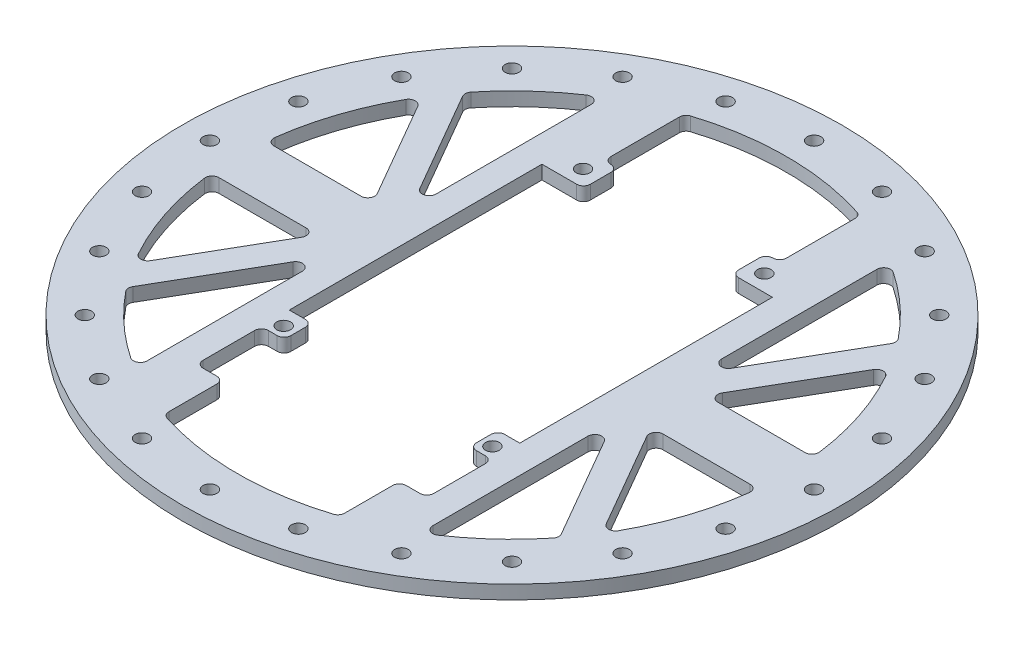
from build123d import *

# Parameters (mm, degrees)
SKETCH1_R           = 76.199999999
SKETCH1_R_2         = 1.5875
BOSS_EXTRUDE1_DEPTH = 3.175


with BuildPart() as part:
    # Sketch1 → Boss-Extrude1 (new body)
    with BuildSketch(Plane(origin=(0, 0, 0), x_dir=(1, 0, 0), z_dir=(0, 1, 0))):
        with Locations(Location((1e-09, -1e-09, 0), (0, 0, 270))):
            Circle(SKETCH1_R)
        with Locations(Location((-34.925, 60.491874454, 0), (0, 0, 270))):
            Circle(SKETCH1_R_2, mode=Mode.SUBTRACT)
        with Locations(Location((20.847659999, 37.48772538, 0), (0, 0, 270))):
            Circle(SKETCH1_R_2, mode=Mode.SUBTRACT)
        with Locations(Location((-18.0785103, -67.469918966, 0), (0, 0, 270))):
            Circle(SKETCH1_R_2, mode=Mode.SUBTRACT)
        with Locations(Location((-49.391408667, -49.391408667, 0), (0, 0, 270))):
            Circle(SKETCH1_R_2, mode=Mode.SUBTRACT)
        with Locations(Location((-67.469918966, -18.0785103, 0), (0, 0, 270))):
            Circle(SKETCH1_R_2, mode=Mode.SUBTRACT)
        with Locations(Location((-67.469918966, 18.0785103, 0), (0, 0, 270))):
            Circle(SKETCH1_R_2, mode=Mode.SUBTRACT)
        with Locations(Location((-49.391408667, 49.391408667, 0), (0, 0, 270))):
            Circle(SKETCH1_R_2, mode=Mode.SUBTRACT)
        with Locations(Location((-18.0785103, 67.469918966, 0), (0, 0, 270))):
            Circle(SKETCH1_R_2, mode=Mode.SUBTRACT)
        with Locations(Location((18.0785103, 67.469918966, 0), (0, 0, 270))):
            Circle(SKETCH1_R_2, mode=Mode.SUBTRACT)
        with Locations(Location((49.391408667, 49.391408667, 0), (0, 0, 270))):
            Circle(SKETCH1_R_2, mode=Mode.SUBTRACT)
        with Locations(Location((67.469918966, 18.0785103, 0), (0, 0, 270))):
            Circle(SKETCH1_R_2, mode=Mode.SUBTRACT)
        with Locations(Location((67.469918966, -18.0785103, 0), (0, 0, 270))):
            Circle(SKETCH1_R_2, mode=Mode.SUBTRACT)
        with Locations(Location((49.391408667, -49.391408667, 0), (0, 0, 270))):
            Circle(SKETCH1_R_2, mode=Mode.SUBTRACT)
        with Locations(Location((18.0785103, -67.469918966, 0), (0, 0, 270))):
            Circle(SKETCH1_R_2, mode=Mode.SUBTRACT)
        with Locations(Location((0, -69.85, 0), (0, 0, 270))):
            Circle(SKETCH1_R_2, mode=Mode.SUBTRACT)
        with Locations(Location((-24.237340001, -28.55227462, 0), (0, 0, 270))):
            Circle(SKETCH1_R_2, mode=Mode.SUBTRACT)
        with Locations(Location((34.925, -60.491874454, 0), (0, 0, 270))):
            Circle(SKETCH1_R_2, mode=Mode.SUBTRACT)
        with Locations(Location((60.491874454, -34.925, 0), (0, 0, 270))):
            Circle(SKETCH1_R_2, mode=Mode.SUBTRACT)
        with Locations(Location((69.85, 0, 0), (0, 0, 270))):
            Circle(SKETCH1_R_2, mode=Mode.SUBTRACT)
        with Locations(Location((60.491874454, 34.925, 0), (0, 0, 270))):
            Circle(SKETCH1_R_2, mode=Mode.SUBTRACT)
        with Locations(Location((34.925, 60.491874454, 0), (0, 0, 270))):
            Circle(SKETCH1_R_2, mode=Mode.SUBTRACT)
        with Locations(Location((0, 69.85, 0), (0, 0, 270))):
            Circle(SKETCH1_R_2, mode=Mode.SUBTRACT)
        with Locations(Location((-60.491874454, 34.925, 0), (0, 0, 270))):
            Circle(SKETCH1_R_2, mode=Mode.SUBTRACT)
        with Locations(Location((-69.85, 0, 0), (0, 0, 270))):
            Circle(SKETCH1_R_2, mode=Mode.SUBTRACT)
        with Locations(Location((-60.491874454, -34.925, 0), (0, 0, 270))):
            Circle(SKETCH1_R_2, mode=Mode.SUBTRACT)
        with Locations(Location((-34.925, -60.491874454, 0), (0, 0, 270))):
            Circle(SKETCH1_R_2, mode=Mode.SUBTRACT)
        with Locations(Location((24.022659999, -28.55227462, 0), (0, 0, 270))):
            Circle(SKETCH1_R_2, mode=Mode.SUBTRACT)
        with Locations(Location((-21.062340001, 37.48772538, 0), (0, 0, 270))):
            Circle(SKETCH1_R_2, mode=Mode.SUBTRACT)
        with BuildLine():
            Line((-52.709304986, 30.9278766), (-39.894076642, 8.731249997))
            ThreePointArc((-39.894076642, 8.731249997), (-39.894076641, 7.143749998), (-41.268891969, 6.349999997))
            Line((-41.268891969, 6.349999997), (-61.401577747, 6.349999997))
            ThreePointArc((-61.401577747, 6.349999997), (-62.593897588, 6.889392346), (-62.975977177, 8.141025638))
            ThreePointArc((-62.975977177, 8.141025638), (-60.307423445, 19.881264477), (-55.47089263, 30.906796512))
            ThreePointArc((-55.47089263, 30.906796512), (-54.096237859, 31.721580352), (-52.709304986, 30.9278766))
        make_face(mode=Mode.SUBTRACT)
        with BuildLine():
            Line((-33.019999998, -15.44963066), (-33.019999998, -51.336912647))
            ThreePointArc((-33.019999998, -51.336912647), (-33.862029165, -52.738493715), (-35.494871793, -52.653243741))
            ThreePointArc((-35.494871793, -52.653243741), (-42.917583757, -46.80097226), (-49.389337066, -39.911694831))
            ThreePointArc((-49.389337066, -39.911694831), (-49.737272965, -39.037652438), (-49.529418968, -38.12015246))
            Line((-49.529418968, -38.12015246), (-35.982315328, -14.65588066))
            ThreePointArc((-35.982315328, -14.65588066), (-34.196624765, -13.916223409), (-33.019999998, -15.44963066))
        make_face(mode=Mode.SUBTRACT)
        with BuildLine():
            Line((33.020000001, -51.336912648), (33.020000001, -15.449630661))
            ThreePointArc((33.020000001, -15.449630661), (34.196624767, -13.916223411), (35.98231533, -14.655880661))
            Line((35.98231533, -14.655880661), (49.529418969, -38.12015246))
            ThreePointArc((49.529418969, -38.12015246), (49.737272966, -39.037652438), (49.389337068, -39.911694831))
            ThreePointArc((49.389337068, -39.911694831), (42.91758376, -46.80097226), (35.494871796, -52.653243741))
            ThreePointArc((35.494871796, -52.653243741), (33.862029168, -52.738493715), (33.020000001, -51.336912648))
        make_face(mode=Mode.SUBTRACT)
        with BuildLine():
            Line((49.529418968, 38.120152454), (35.982315328, 14.655880655))
            ThreePointArc((35.982315328, 14.655880655), (34.196624767, 13.916223407), (33.020000001, 15.449630655))
            Line((33.020000001, 15.449630655), (33.020000001, 51.336912642))
            ThreePointArc((33.020000001, 51.336912642), (33.862029167, 52.738493709), (35.494871796, 52.653243736))
            ThreePointArc((35.494871796, 52.653243736), (42.91758376, 46.800972255), (49.389337068, 39.911694825))
            ThreePointArc((49.389337068, 39.911694825), (49.737272966, 39.037652432), (49.529418968, 38.120152454))
        make_face(mode=Mode.SUBTRACT)
        with BuildLine():
            Line((18.730764569, 33.677786337), (26.5373616, 33.677786337))
            Line((26.5373616, 33.677786337), (26.5373616, -24.742213663))
            Line((26.5373616, -24.742213663), (23.042500002, -24.742213663))
            ThreePointArc((23.042500002, -24.742213663), (21.919967987, -25.207181648), (21.455000002, -26.329713663))
            Line((21.455000002, -26.329713663), (21.455000002, -29.667200003))
            ThreePointArc((21.455000002, -29.667200003), (21.919967987, -30.789732018), (23.042500002, -31.254700003))
            Line((23.042500002, -31.254700003), (25.082500001, -31.254700003))
            ThreePointArc((25.082500001, -31.254700003), (26.205032016, -31.719667988), (26.670000001, -32.842200003))
            Line((26.670000001, -32.842200003), (26.670000001, -44.767500003))
            ThreePointArc((26.670000001, -44.767500003), (26.205032016, -45.890032018), (25.082500001, -46.355000003))
            Line((25.082500001, -46.355000003), (21.907500001, -46.355000003))
            ThreePointArc((21.907500001, -46.355000003), (20.784967986, -46.819967988), (20.320000001, -47.942500003))
            Line((20.320000001, -47.942500003), (20.320000001, -59.010601593))
            ThreePointArc((20.320000001, -59.010601593), (20.013645009, -59.948057575), (19.212820514, -60.523693941))
            ThreePointArc((19.212820514, -60.523693941), (1e-09, -63.500000003), (-19.212820512, -60.523693941))
            ThreePointArc((-19.212820512, -60.523693941), (-20.013645007, -59.948057575), (-20.319999999, -59.010601593))
            Line((-20.319999999, -59.010601593), (-20.319999999, -47.942500003))
            ThreePointArc((-20.319999999, -47.942500003), (-20.784967984, -46.819967988), (-21.907499999, -46.355000003))
            Line((-21.907499999, -46.355000003), (-25.082499999, -46.355000003))
            ThreePointArc((-25.082499999, -46.355000003), (-26.205032014, -45.890032018), (-26.669999999, -44.767500003))
            Line((-26.669999999, -44.767500003), (-26.669999999, -32.842200003))
            ThreePointArc((-26.669999999, -32.842200003), (-26.205032014, -31.719667988), (-25.082499999, -31.254700003))
            Line((-25.082499999, -31.254700003), (-23.0425, -31.254700003))
            ThreePointArc((-23.0425, -31.254700003), (-21.919967985, -30.789732018), (-21.455, -29.667200003))
            Line((-21.455, -29.667200003), (-21.455, -26.329713663))
            ThreePointArc((-21.455, -26.329713663), (-21.919967985, -25.207181648), (-23.0425, -24.742213663))
            Line((-23.0425, -24.742213663), (-26.7518384, -24.742213663))
            Line((-26.7518384, -24.742213663), (-26.7518384, 33.677786337))
            Line((-26.7518384, 33.677786337), (-18.732499999, 33.677786337))
            ThreePointArc((-18.732499999, 33.677786337), (-17.609967984, 34.142754322), (-17.144999999, 35.265286337))
            Line((-17.144999999, 35.265286337), (-17.144999999, 39.997748358))
            ThreePointArc((-17.144999999, 39.997748358), (-17.609967984, 41.120280373), (-18.732499999, 41.585248358))
            ThreePointArc((-18.732499999, 41.585248358), (-19.855032014, 42.050216343), (-20.319999999, 43.172748358))
            Line((-20.319999999, 43.172748358), (-20.319999999, 59.010601587))
            ThreePointArc((-20.319999999, 59.010601587), (-20.013645007, 59.948057569), (-19.212820512, 60.523693935))
            ThreePointArc((-19.212820512, 60.523693935), (1e-09, 63.499999997), (19.212820514, 60.523693936))
            ThreePointArc((19.212820514, 60.523693936), (20.013645009, 59.948057569), (20.320000001, 59.010601587))
            Line((20.320000001, 59.010601587), (20.320000001, 43.172748358))
            ThreePointArc((20.320000001, 43.172748358), (19.855032016, 42.050216343), (18.732500001, 41.585248358))
            ThreePointArc((18.732500001, 41.585248358), (17.609967986, 41.120280373), (17.145000001, 39.997748358))
            Line((17.145000001, 39.997748358), (17.143275501, 35.27117833))
            ThreePointArc((17.143275501, 35.27117833), (17.606151348, 34.144839392), (18.730764569, 33.677786337))
        make_face(mode=Mode.SUBTRACT)
        with BuildLine():
            Line((52.709304987, -30.927876605), (39.894076643, -8.731250002))
            ThreePointArc((39.894076643, -8.731250002), (39.894076643, -7.143750002), (41.268891971, -6.350000002))
            Line((41.268891971, -6.350000002), (61.401577749, -6.350000002))
            ThreePointArc((61.401577749, -6.350000002), (62.593897591, -6.889392351), (62.97597718, -8.141025644))
            ThreePointArc((62.97597718, -8.141025644), (60.307423448, -19.881264482), (55.470892631, -30.906796518))
            ThreePointArc((55.470892631, -30.906796518), (54.096237861, -31.721580357), (52.709304987, -30.927876605))
        make_face(mode=Mode.SUBTRACT)
        with BuildLine():
            Line((-33.019999999, 51.336912641), (-33.019999999, 15.449630654))
            ThreePointArc((-33.019999999, 15.449630654), (-34.196624765, 13.916223405), (-35.982315327, 14.655880654))
            Line((-35.982315327, 14.655880654), (-49.529418967, 38.120152453))
            ThreePointArc((-49.529418967, 38.120152453), (-49.737272964, 39.037652432), (-49.389337065, 39.911694825))
            ThreePointArc((-49.389337065, 39.911694825), (-42.917583758, 46.800972255), (-35.494871794, 52.653243736))
            ThreePointArc((-35.494871794, 52.653243736), (-33.862029165, 52.73849371), (-33.019999999, 51.336912641))
        make_face(mode=Mode.SUBTRACT)
        with BuildLine():
            Line((61.401577749, 6.349999997), (41.268891972, 6.349999997))
            ThreePointArc((41.268891972, 6.349999997), (39.894076644, 7.143749997), (39.894076644, 8.731249997))
            Line((39.894076644, 8.731249997), (52.709304988, 30.9278766))
            ThreePointArc((52.709304988, 30.9278766), (54.096237862, 31.721580351), (55.470892631, 30.906796512))
            ThreePointArc((55.470892631, 30.906796512), (60.307423447, 19.881264476), (62.975977178, 8.141025638))
            ThreePointArc((62.975977178, 8.141025638), (62.59389759, 6.889392347), (61.401577749, 6.349999997))
        make_face(mode=Mode.SUBTRACT)
        with BuildLine():
            Line((-61.401577748, -6.35), (-41.268891971, -6.35))
            ThreePointArc((-41.268891971, -6.35), (-39.894076642, -7.14375), (-39.894076642, -8.73125))
            Line((-39.894076642, -8.73125), (-52.709304986, -30.927876603))
            ThreePointArc((-52.709304986, -30.927876603), (-54.09623786, -31.721580354), (-55.47089263, -30.906796515))
            ThreePointArc((-55.47089263, -30.906796515), (-60.307423446, -19.881264479), (-62.975977177, -8.141025641))
            ThreePointArc((-62.975977177, -8.141025641), (-62.593897588, -6.889392349), (-61.401577748, -6.35))
        make_face(mode=Mode.SUBTRACT)
    extrude(amount=BOSS_EXTRUDE1_DEPTH)


solid = part.part
